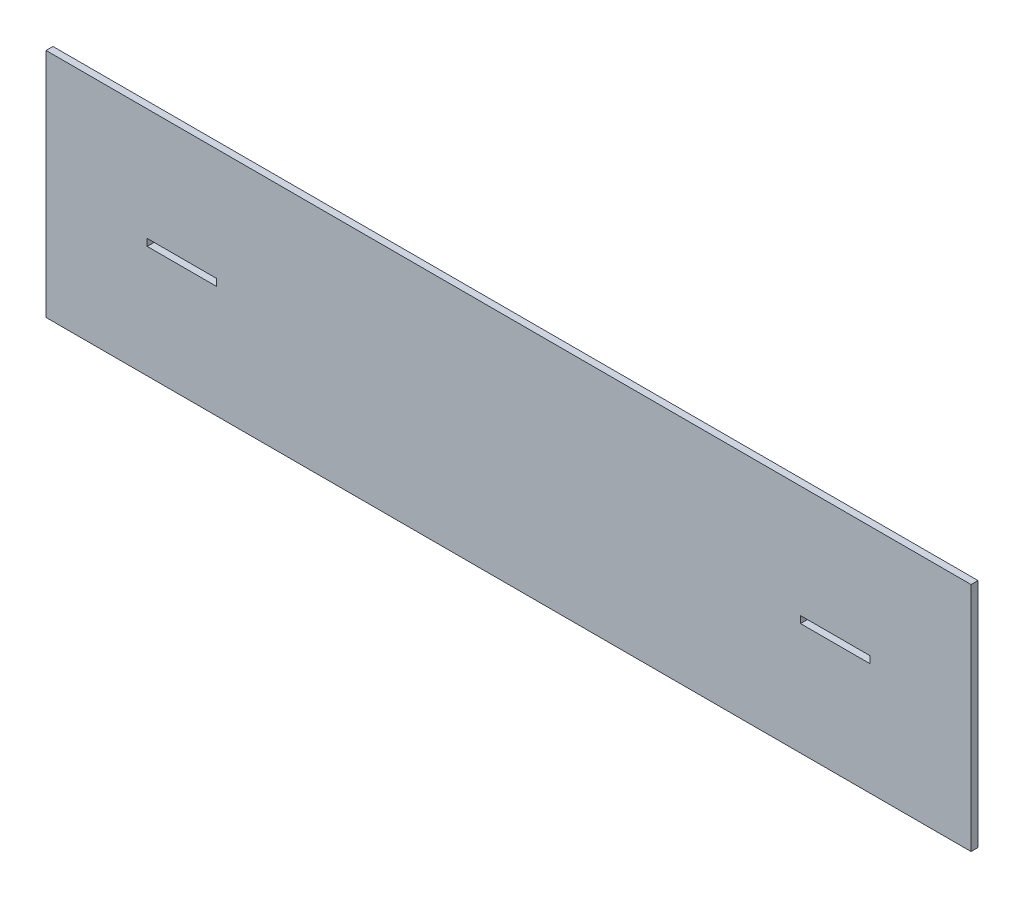
from build123d import *

# Parameters (mm, degrees)
CROQUIS1_W              = 400
CROQUIS1_H              = 100
CROQUIS1_W_2            = 30
CROQUIS1_H_2            = 3
SALIENTE_EXTRUIR1_DEPTH = 3


with BuildPart() as part:
    # Croquis1 → Saliente-Extruir1 (new body)
    with BuildSketch(Plane.XY):
        Rectangle(CROQUIS1_W, CROQUIS1_H)
        with Locations((141.24, 0)):
            Rectangle(CROQUIS1_W_2, CROQUIS1_H_2, mode=Mode.SUBTRACT)
        with Locations((-141.24, 0)):
            Rectangle(CROQUIS1_W_2, CROQUIS1_H_2, mode=Mode.SUBTRACT)
    extrude(amount=SALIENTE_EXTRUIR1_DEPTH)


solid = part.part
